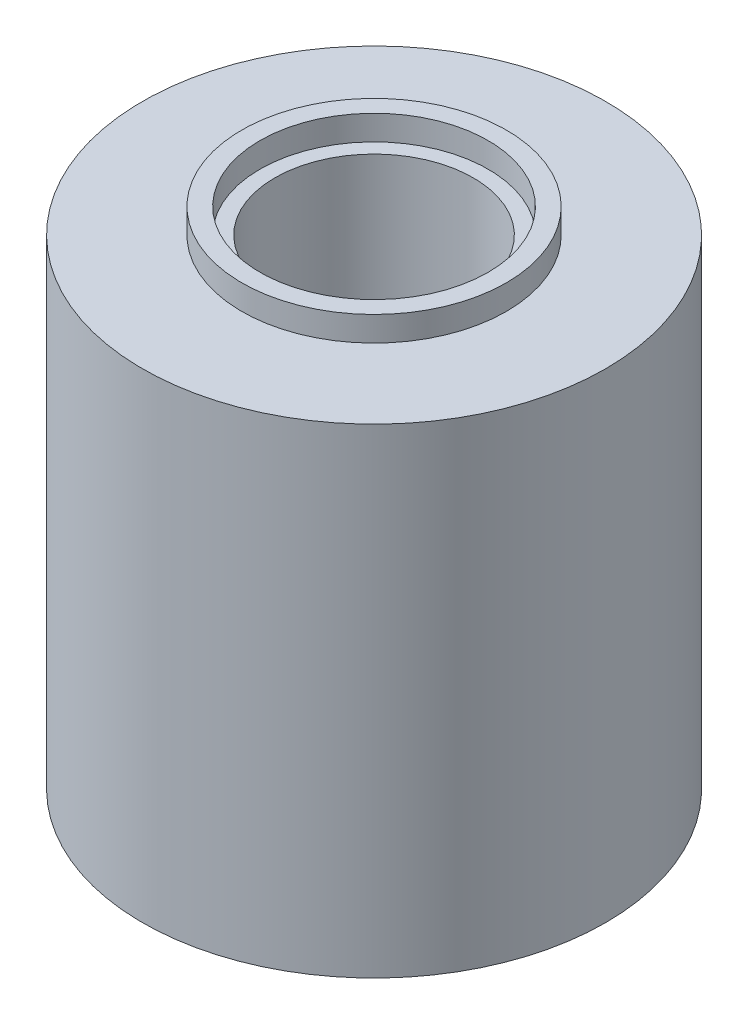
from build123d import *


with BuildPart() as part:
    # Esquisse1 → Révolution1 (revolve)
    with BuildSketch(Plane.XY):
        Polygon((8, 0), (8, 1.5), (14, 1.5), (14, 30.5), (8, 30.5), (8, 32), (6.9, 32), (6.9, 30.5), (6, 30.5), (6, 1.5), (6.9, 1.5), (6.9, 0), align=None)
    revolve(axis=Axis((0, 0, 0), (0, 1, 0)))


solid = part.part
